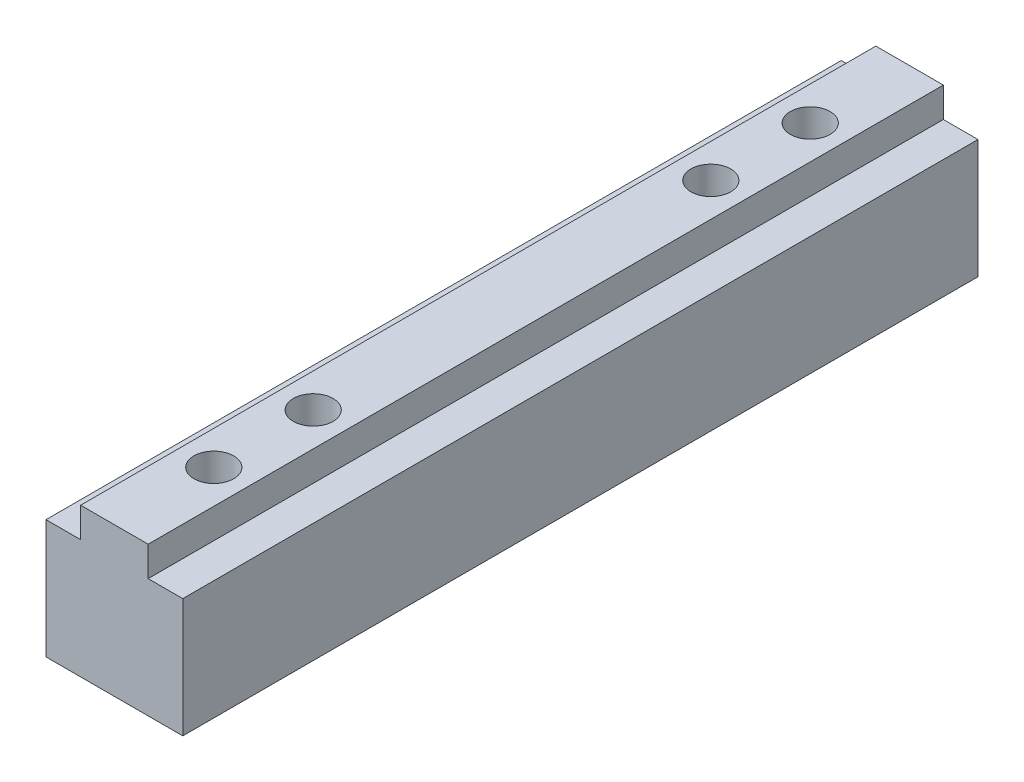
from build123d import *

# Parameters (mm, degrees)
SKETCH1_W           = 21.844
SKETCH1_H           = 127
SKETCH1_R           = 3.175
BOSS_EXTRUDE1_DEPTH = 23.749
SKETCH3_W           = 5.531865031
SKETCH3_H           = 127
CUT_EXTRUDE2_DEPTH  = 4.7625


with BuildPart() as part:
    # Sketch1 → Boss-Extrude1 (new body)
    with BuildSketch(Plane(origin=(0, 0, 0), x_dir=(1, 0, 0), z_dir=(0, 1, 0))):
        Rectangle(SKETCH1_W, SKETCH1_H)
        with Locations(Location((0, 31.75, 0), (0, 0, 90))):
            Circle(SKETCH1_R, mode=Mode.SUBTRACT)
        with Locations(Location((0, 47.625, 0), (0, 0, 90))):
            Circle(SKETCH1_R, mode=Mode.SUBTRACT)
        with Locations(Location((0, -31.75, 0), (0, 0, 90))):
            Circle(SKETCH1_R, mode=Mode.SUBTRACT)
        with Locations(Location((0, -47.625, 0), (0, 0, 90))):
            Circle(SKETCH1_R, mode=Mode.SUBTRACT)
    extrude(amount=BOSS_EXTRUDE1_DEPTH)

    # Sketch3 → Cut-Extrude2 (cut)
    with BuildSketch(Plane(origin=(0, 23.749, 0), x_dir=(1, 0, 0), z_dir=(0, 1, 0))):
        with Locations((-8.156067484, 0)):
            Rectangle(SKETCH3_W, SKETCH3_H)
        with Locations((8.156067484, 0)):
            Rectangle(SKETCH3_W, SKETCH3_H)
    extrude(amount=-CUT_EXTRUDE2_DEPTH, mode=Mode.SUBTRACT)


solid = part.part
